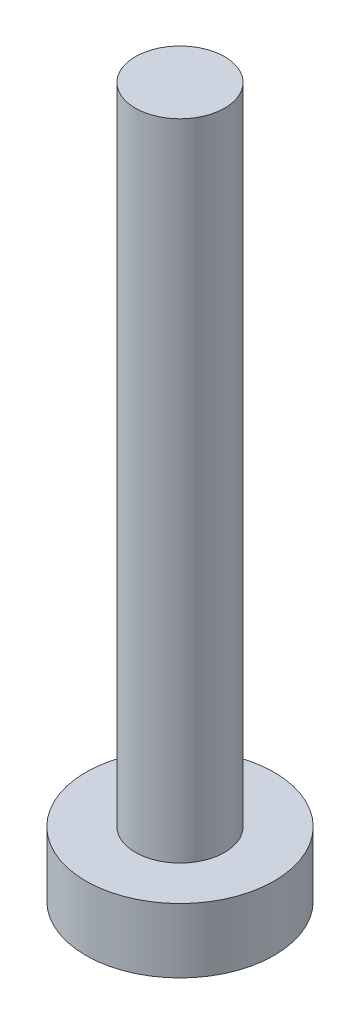
from build123d import *

# Parameters (mm, degrees)
SKETCH2_R           = 1.9
BOSS_EXTRUDE1_DEPTH = 1.3
SKETCH3_R           = 0.9
BOSS_EXTRUDE2_DEPTH = 13
CUT_EXTRUDE1_DEPTH  = 0.7


with BuildPart() as part:
    # Sketch2 → Boss-Extrude1 (new body)
    with BuildSketch(Plane(origin=(0, 0, 0), x_dir=(1, 0, 0), z_dir=(0, 1, 0))):
        with Locations(Location((0, 0, 0), (0, 0, 270))):
            Circle(SKETCH2_R)
    extrude(amount=BOSS_EXTRUDE1_DEPTH)

    # Sketch3 → Boss-Extrude2 (add)
    with BuildSketch(Plane(origin=(0, 1.3, 0), x_dir=(1, 0, 0), z_dir=(0, 1, 0))):
        with Locations(Location((0, 0, 0), (0, 0, 90))):
            Circle(SKETCH3_R)
    extrude(amount=BOSS_EXTRUDE2_DEPTH)

    # Sketch4 → Cut-Extrude1 (cut)
    with BuildSketch(Plane.XZ):
        Polygon((0.75055535, 0), (0.375277675, 0.65), (-0.375277675, 0.65), (-0.75055535, 0), (-0.375277675, -0.65), (0.375277675, -0.65), align=None)
    extrude(amount=-CUT_EXTRUDE1_DEPTH, mode=Mode.SUBTRACT)


solid = part.part
